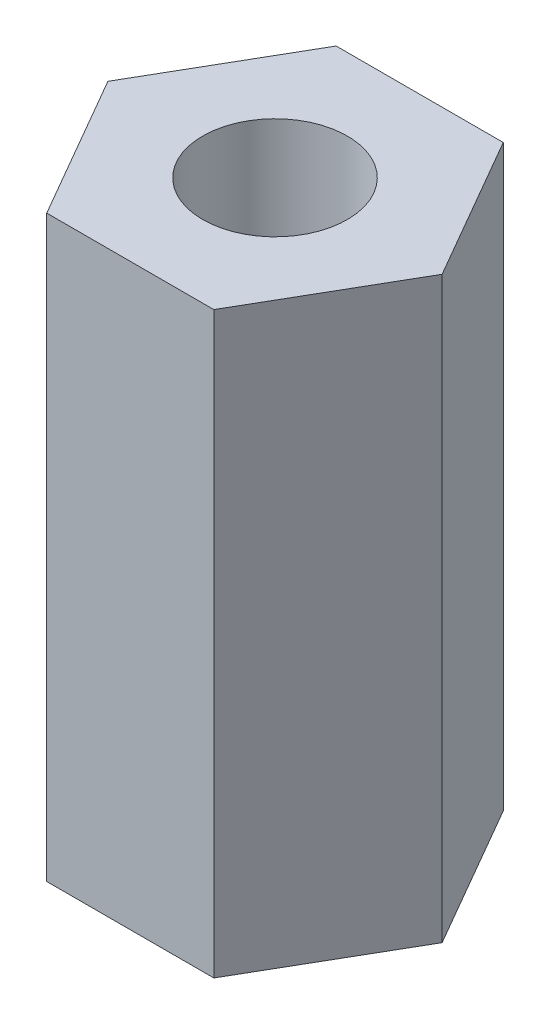
from build123d import *

# Parameters (mm, degrees)
SKETCH1_R           = 3.175
BOSS_EXTRUDE1_DEPTH = 25.4


with BuildPart() as part:
    # Sketch1 → Boss-Extrude1 (new body)
    with BuildSketch(Plane(origin=(0, 0, 0), x_dir=(1, 0, 0), z_dir=(0, 1, 0))):
        Polygon((-3.666174209, 6.35), (-7.332348419, 0), (-3.666174209, -6.35), (3.666174209, -6.35), (7.332348419, 0), (3.666174209, 6.35), align=None)
        with Locations(Location((0, 0, 0), (0, 0, 270))):
            Circle(SKETCH1_R, mode=Mode.SUBTRACT)
    extrude(amount=BOSS_EXTRUDE1_DEPTH)


solid = part.part
